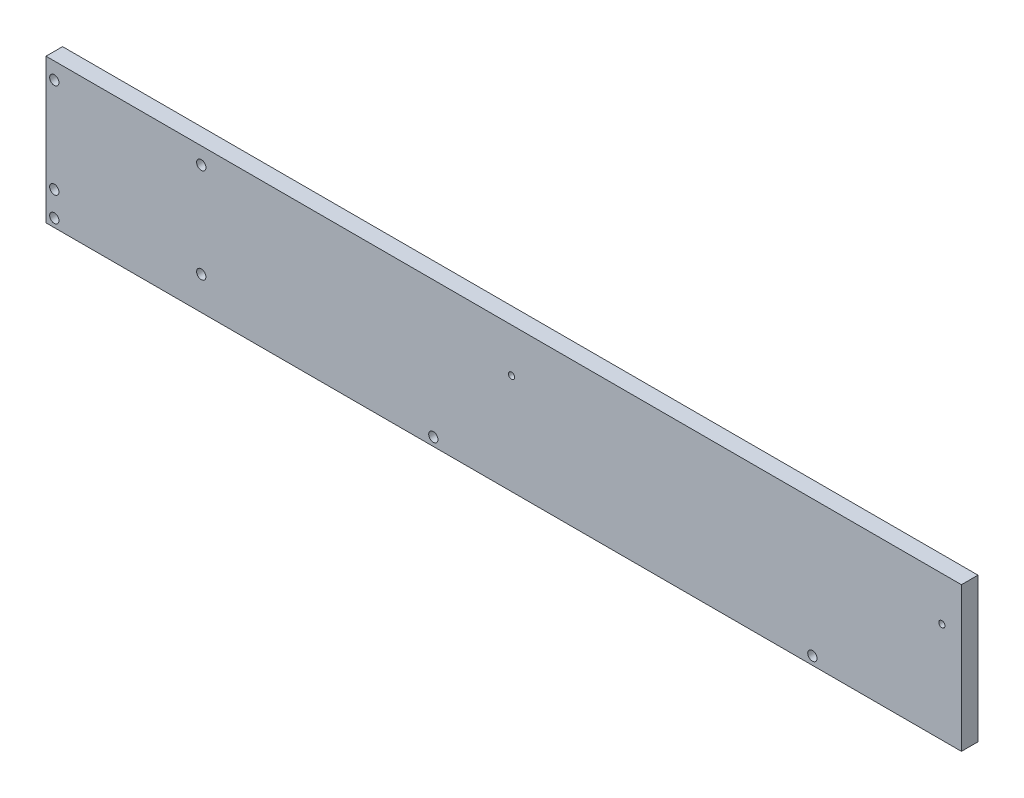
from build123d import *

# Parameters (mm, degrees)
SKETCH1_W           = 350.99
SKETCH1_H           = 55.35
SKETCH1_R           = 1.7859375
SKETCH1_R_2         = 1.190625
BOSS_EXTRUDE1_DEPTH = 6.35


with BuildPart() as part:
    # Sketch1 → Boss-Extrude1 (new body)
    with BuildSketch(Plane.XY):
        with Locations((175.495, 27.675)):
            Rectangle(SKETCH1_W, SKETCH1_H)
        with Locations((148.5075, 3.175)):
            Circle(SKETCH1_R, mode=Mode.SUBTRACT)
        with Locations((3.175, 12.7)):
            Circle(SKETCH1_R, mode=Mode.SUBTRACT)
        with Locations((3.175, 49)):
            Circle(SKETCH1_R, mode=Mode.SUBTRACT)
        with Locations((3.175, 3.175)):
            Circle(SKETCH1_R, mode=Mode.SUBTRACT)
        with Locations((178.49, 38.5)):
            Circle(SKETCH1_R_2, mode=Mode.SUBTRACT)
        with Locations((343.49, 38.5)):
            Circle(SKETCH1_R_2, mode=Mode.SUBTRACT)
        with Locations((293.84, 3.175)):
            Circle(SKETCH1_R, mode=Mode.SUBTRACT)
        with Locations((59.525, 12.7)):
            Circle(SKETCH1_R, mode=Mode.SUBTRACT)
        with Locations((59.525, 49)):
            Circle(SKETCH1_R, mode=Mode.SUBTRACT)
    extrude(amount=BOSS_EXTRUDE1_DEPTH)


solid = part.part
